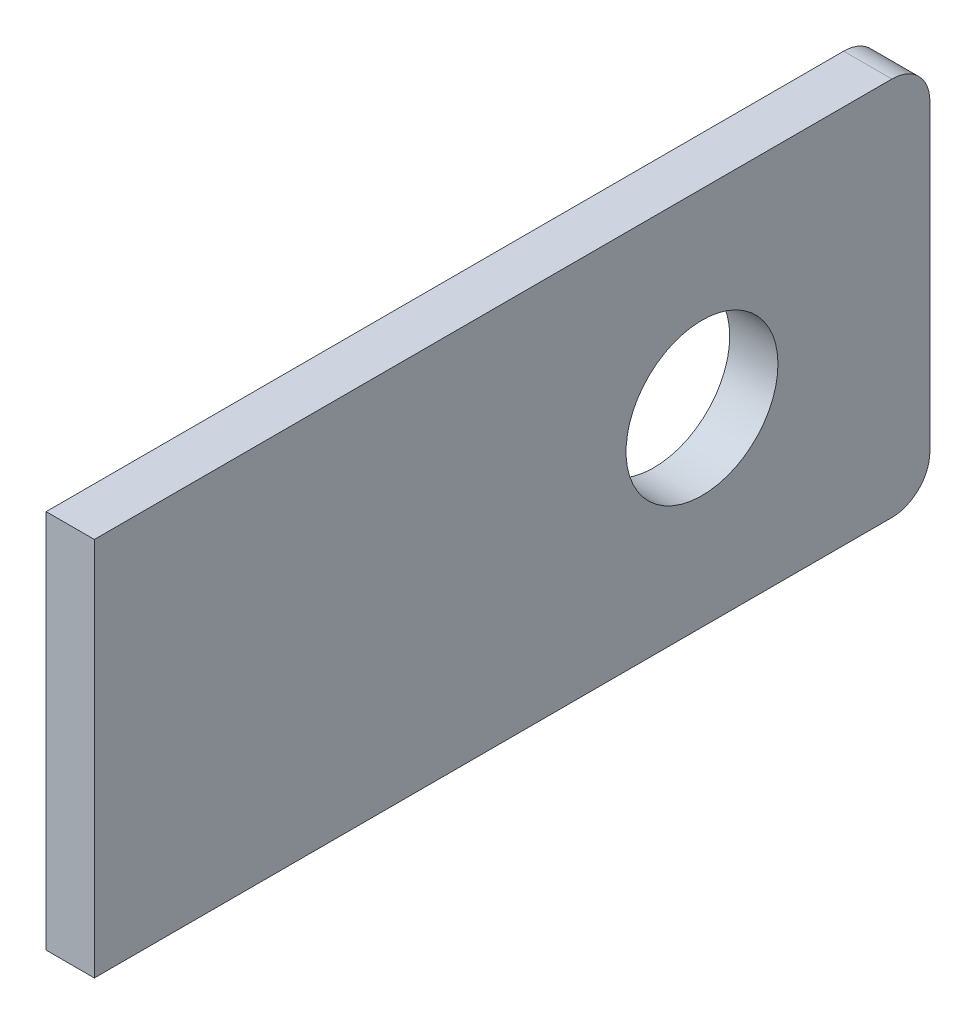
from build123d import *

# Parameters (mm, degrees)
SKETCH1_W           = 110
SKETCH1_H           = 50
SKETCH1_R           = 10
BOSS_EXTRUDE1_DEPTH = 3.175
FILLET1_R           = 5


with BuildPart() as part:
    # Sketch1 → Boss-Extrude1 (new, symmetric)
    with BuildSketch(Plane(origin=(0, 0, 0), x_dir=(0, 0, -1), z_dir=(1, 0, 0))):
        with Locations((-25, 0)):
            Rectangle(SKETCH1_W, SKETCH1_H)
        Circle(SKETCH1_R, mode=Mode.SUBTRACT)
    extrude(amount=BOSS_EXTRUDE1_DEPTH, both=True)

    # Fillet1
    fillet1_edges = [part.edges().sort_by_distance(p)[0] for p in [
        (0, -25, -30),
        (0, 25, -30),
    ]]
    fillet(fillet1_edges, radius=FILLET1_R)


solid = part.part
